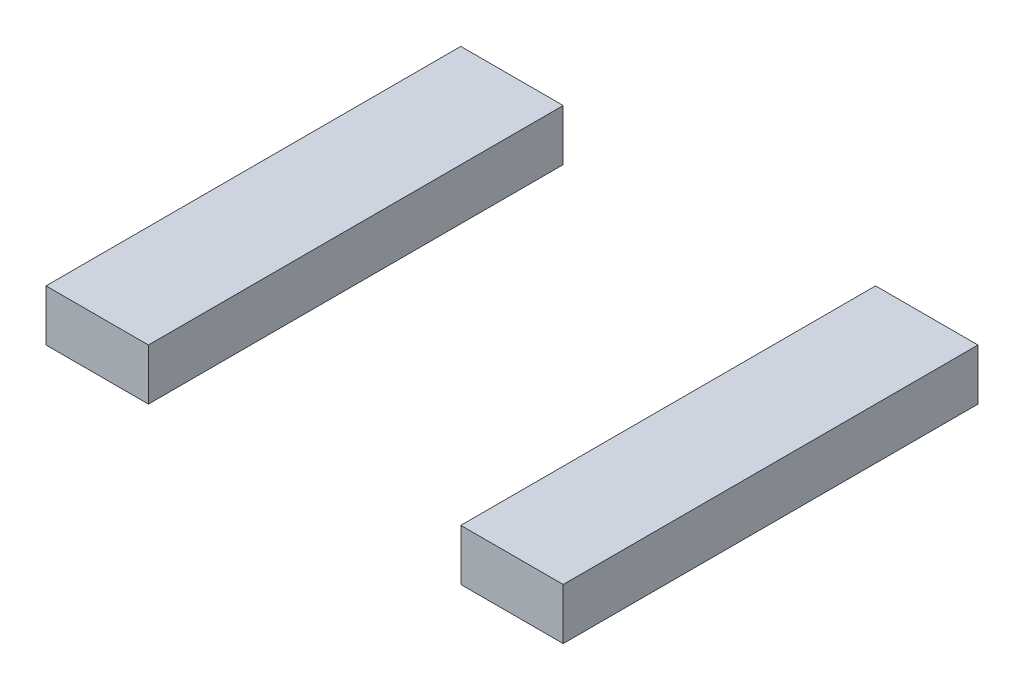
from build123d import *

# Parameters (mm, degrees)
SKETCH1_W             = 20
SKETCH1_H             = 81
BOSS_EXTRUDE1_DEPTH   = 10
BOSS_EXTRUDE1_2_DEPTH = 10


with BuildPart() as part:
    # Sketch1 → Boss-Extrude1 (new body)
    with BuildSketch(Plane(origin=(0, 0, 0), x_dir=(1, 0, 0), z_dir=(0, 1, 0))):
        with Locations((-40.5, 0)):
            Rectangle(SKETCH1_W, SKETCH1_H)
    extrude(amount=BOSS_EXTRUDE1_DEPTH)


with BuildPart() as body_2:
    # Sketch1 → Boss-Extrude1 2 (new body)
    with BuildSketch(Plane(origin=(0, 0, 0), x_dir=(1, 0, 0), z_dir=(0, 1, 0))):
        with Locations((40.5, 0)):
            Rectangle(SKETCH1_W, SKETCH1_H)
    extrude(amount=BOSS_EXTRUDE1_2_DEPTH)


solid = Compound([part.part, body_2.part])
